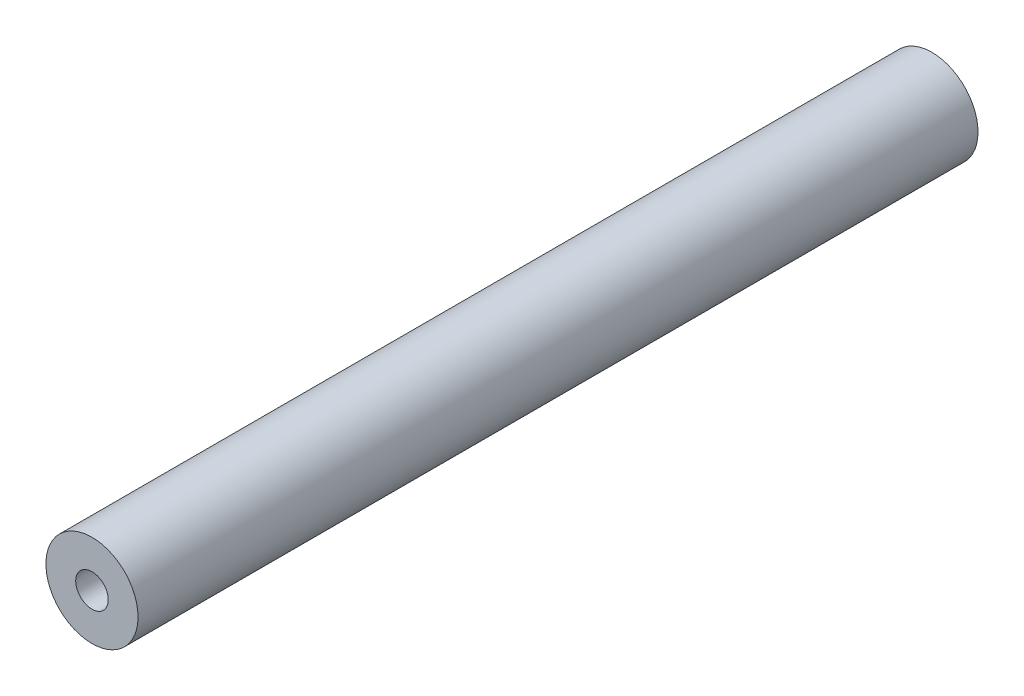
from build123d import *

# Parameters (mm, degrees)
AXLE_ENVELOPE_START = -75
SKETCH_1_R          = 8.5
SKETCH_1_R_2        = 3
AXLE_ENVELOPE_DEPTH = 155


with BuildPart() as part:
    # Эскиз1 → Axle_envelope (new body)
    with BuildSketch(Plane.XY.offset(AXLE_ENVELOPE_START)):
        Circle(SKETCH_1_R)
        Circle(SKETCH_1_R_2, mode=Mode.SUBTRACT)
    extrude(amount=AXLE_ENVELOPE_DEPTH)


solid = part.part
